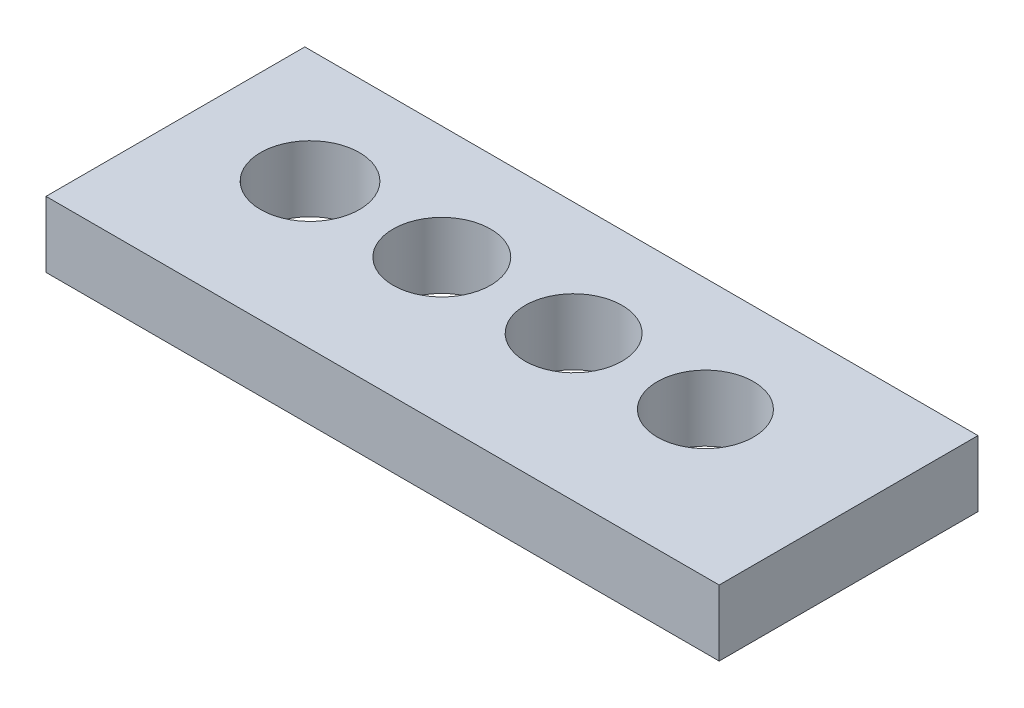
from build123d import *

# Parameters (mm, degrees)
SKETCH1_W           = 102.146812647
SKETCH1_H           = 39.274541857
SKETCH1_R           = 7.5
SKETCH1_R_2         = 7.4
SKETCH1_R_3         = 7.35
SKETCH1_R_4         = 7.3
BOSS_EXTRUDE1_DEPTH = 10


with BuildPart() as part:
    # Sketch1 → Boss-Extrude1 (new body)
    with BuildSketch(Plane(origin=(0, 0, 0), x_dir=(1, 0, 0), z_dir=(0, 1, 0))):
        with Locations((33.050263456, -2.401192088)):
            Rectangle(SKETCH1_W, SKETCH1_H)
        with Locations(Location((0, 0, 0), (0, 0, 270))):
            Circle(SKETCH1_R, mode=Mode.SUBTRACT)
        with Locations(Location((20, 0, 0), (0, 0, 270))):
            Circle(SKETCH1_R_2, mode=Mode.SUBTRACT)
        with Locations(Location((40, 0, 0), (0, 0, 270))):
            Circle(SKETCH1_R_3, mode=Mode.SUBTRACT)
        with Locations(Location((60, 0, 0), (0, 0, 270))):
            Circle(SKETCH1_R_4, mode=Mode.SUBTRACT)
    extrude(amount=BOSS_EXTRUDE1_DEPTH)


solid = part.part
